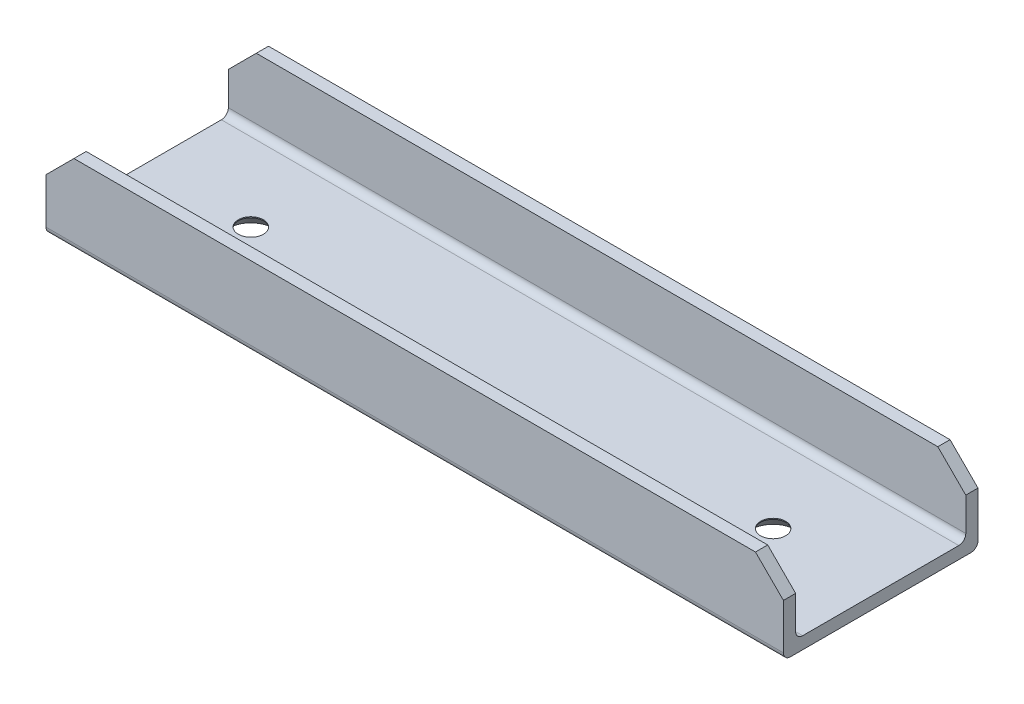
from build123d import *

# Parameters (mm, degrees)
SKETCH1_W           = 105.55
SKETCH1_H           = 27.85
BOSS_EXTRUDE1_DEPTH = 11.5
SKETCH2_W           = 105.55
SKETCH2_H           = 24.35
CUT_EXTRUDE1_DEPTH  = 9.75
CHAMFER1_SIZE       = 4
FILLET1_R           = 1
HOLE1_D             = 3.6
HOLE1_CSINK_D       = 6.4
HOLE1_CSINK_ANGLE   = 82


with BuildPart() as part:
    # Sketch1 → Boss-Extrude1 (new body)
    with BuildSketch(Plane(origin=(0, 0, 0), x_dir=(1, 0, 0), z_dir=(0, 1, 0))):
        Rectangle(SKETCH1_W, SKETCH1_H)
    extrude(amount=BOSS_EXTRUDE1_DEPTH)

    # Sketch2 → Cut-Extrude1 (cut)
    with BuildSketch(Plane(origin=(0, 11.5, 0), x_dir=(1, 0, 0), z_dir=(0, 1, 0))):
        Rectangle(SKETCH2_W, SKETCH2_H)
    extrude(amount=-CUT_EXTRUDE1_DEPTH, mode=Mode.SUBTRACT)

    # Chamfer1
    chamfer1_edges = [part.edges().sort_by_distance(p)[0] for p in [
        (-52.775, 11.5, -13.05),
        (52.775, 11.5, -13.05),
        (-52.775, 11.5, 13.05),
        (52.775, 11.5, 13.05),
    ]]
    chamfer(chamfer1_edges, length=CHAMFER1_SIZE)

    # Fillet1
    fillet1_edges = [part.edges().sort_by_distance(p)[0] for p in [
        (0, 1.75, -12.175),
        (0, 1.75, 12.175),
        (0, 0, 13.925),
        (0, 0, -13.925),
    ]]
    fillet(fillet1_edges, radius=FILLET1_R)

    # Hole1 (through all)
    with Locations(Plane(origin=(-37.375, 0, 0), x_dir=(0, 0, -1), z_dir=(0, -1, 0))):
        with Locations((0, 0), (0, 74.75)):
            CounterSinkHole(HOLE1_D / 2, HOLE1_CSINK_D / 2, counter_sink_angle=HOLE1_CSINK_ANGLE)


solid = part.part
